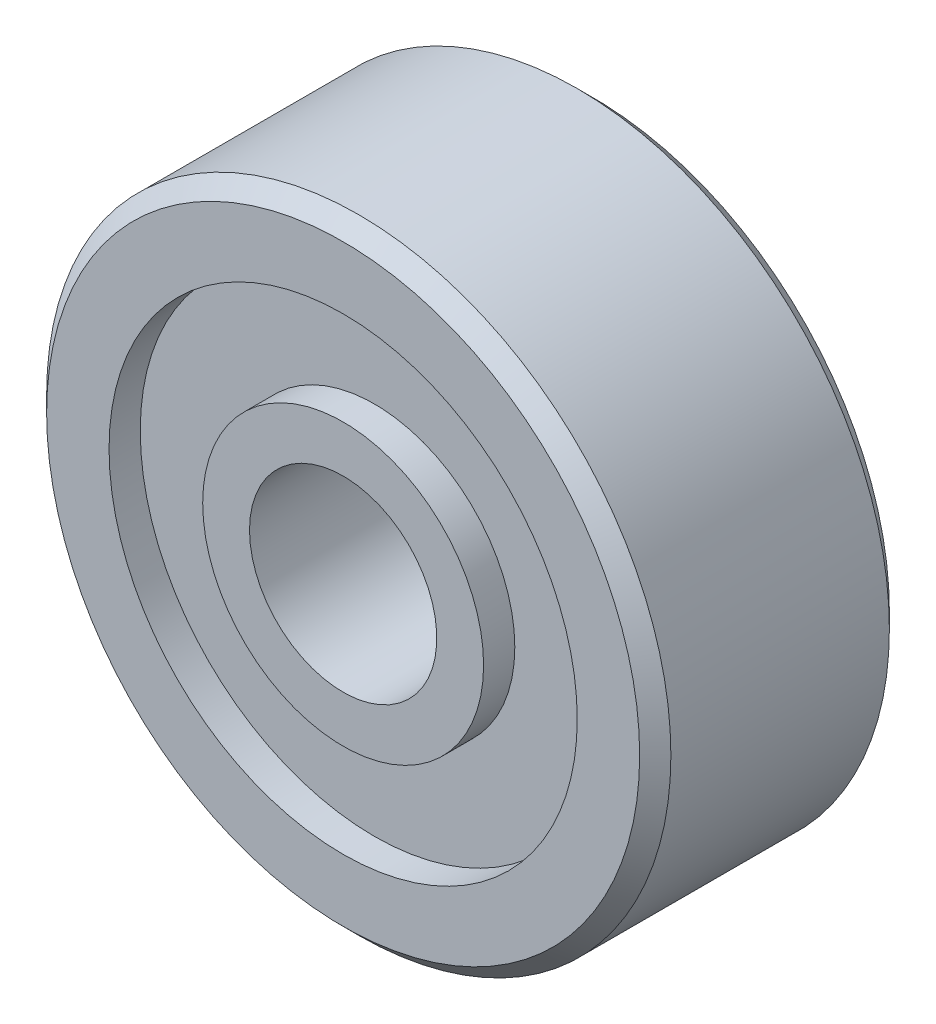
from build123d import *


with BuildPart() as part:
    # Sketch1 → Revolve1 (revolve)
    with BuildSketch(Plane.XZ, mode=Mode.PRIVATE) as revolve1_sk:
        Polygon((6.5, 1.25), (6.25, 1.5), (5.25, 1.5), (5.25, 1), (3.75, 1), (3.75, 1.5), (3, 1.5), (3, -2.5), (3.75, -2.5), (3.75, -2), (5.25, -2), (5.25, -2.5), (6.25, -2.5), (6.5, -2.25), align=None)
    revolve(revolve1_sk.sketch.rotate(Axis((1.5, 0, 2.5), (0, 0, -1)), 180), axis=Axis((1.5, 0, 2.5), (0, 0, -1)))


solid = part.part
